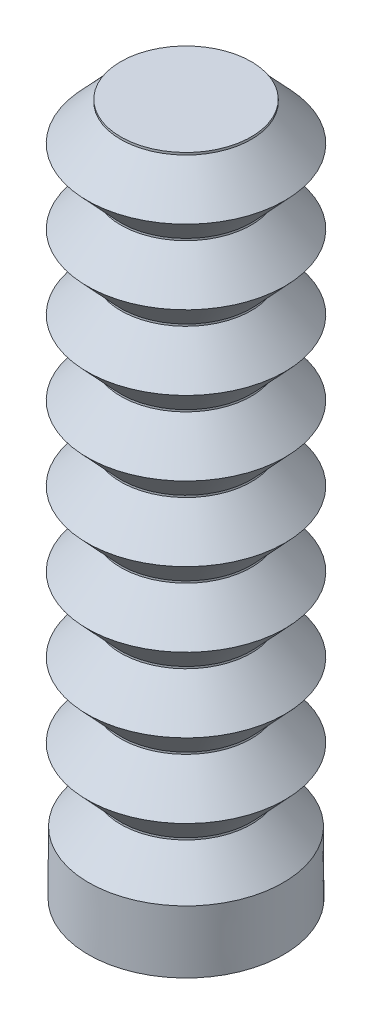
from build123d import *


with BuildPart() as part:
    # Sketch1 → Revolve3 (revolve)
    with BuildSketch(Plane.XY, mode=Mode.PRIVATE) as revolve3_sk:
        Polygon((-2.131630681, 34.102954004), (-2.131630681, 33.988409531), (-0.431630681, 32.163409531), (-2.131630681, 30.338409531), (-2.131630681, 30.238409531), (-0.431630681, 28.413409531), (-2.131630681, 26.588409531), (-2.131630681, 26.488409531), (-0.431630681, 24.663409531), (-2.131630681, 22.838409531), (-2.131630681, 22.738409531), (-0.431630681, 20.913409531), (-2.131630681, 19.088409531), (-2.131630681, 18.988409531), (-0.431630681, 17.163409531), (-2.131630681, 15.338409531), (-2.131630681, 15.238409531), (-0.431630681, 13.413409531), (-2.131630681, 11.588409531), (-2.131630681, 11.488409531), (-0.431630681, 9.663409531), (-2.131630681, 7.838409531), (-2.131630681, 7.738409531), (-0.431630681, 5.913409531), (-2.131630681, 4.088409531), (-2.131630681, 3.988409531), (-0.513071755, 2.245501685), (-0.495122529, -0.9), (-5.431630681, -0.9), (-5.431630681, 34.102954004), align=None)
    revolve(revolve3_sk.sketch.rotate(Axis((-5.431630681, 34.102954004, 0), (0, -1, 0)), 180), axis=Axis((-5.431630681, 34.102954004, 0), (0, -1, 0)))


solid = part.part
